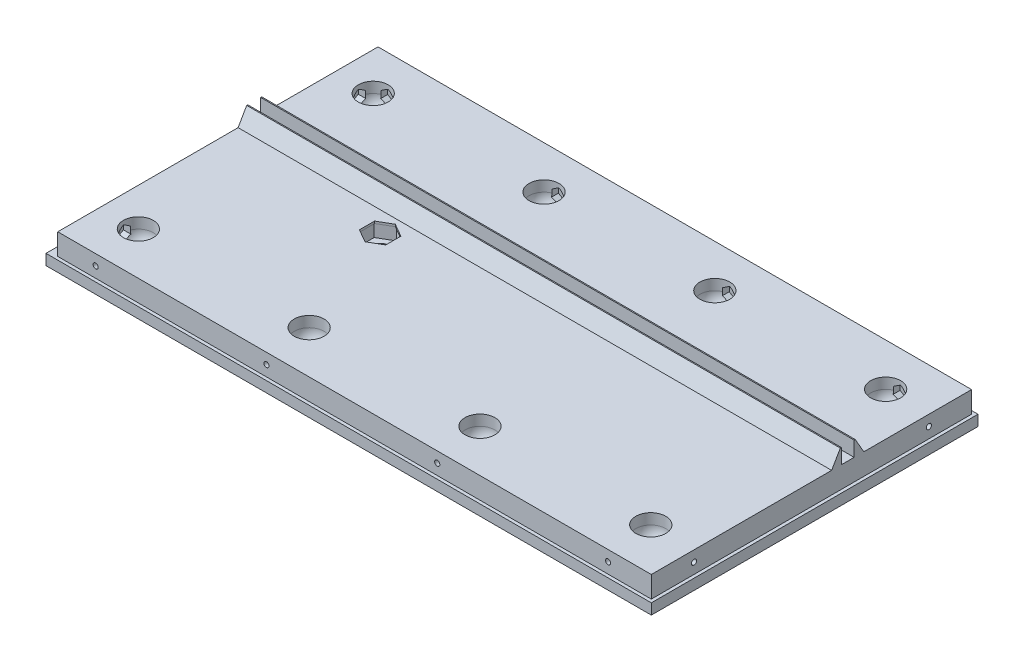
from build123d import *

# Parameters (mm, degrees)
ESQUISSE1_W                     = 283.5
ESQUISSE1_H                     = 153
BOSS_EXTRU_1_DEPTH              = 15
ENL_V_START                     = -5
ESQUISSE3_W                     = 283.5
ESQUISSE3_H                     = 153
ESQUISSE3_W_2                   = 280.5
ESQUISSE3_H_2                   = 150
ENL_V_DE_MAT_EXTRU_MINCE1_DEPTH = 157.772409576
ESQUISSE4_R                     = 1.2
ENL_V_MAT_EXTRU_1_DEPTH         = 12
ENL_V_MAT_EXTRU_2_DEPTH         = 3.5
ESQUISSE6_R                     = 1.2
ENL_V_MAT_EXTRU_3_DEPTH         = 12
ENL_V_MAT_EXTRU_4_DEPTH         = 3.5
R_P_TITION_LIN_AIRE1_COUNT      = 4
R_P_TITION_LIN_AIRE1_PITCH      = 80
SYM_TRIE1_COPY_1_SKETCH_R       = 1.2
SYM_TRIE1_COPY_1_DEPTH          = 12
SYM_TRIE1_COPY_2_SKETCH_R       = 1.2
SYM_TRIE1_COPY_2_DEPTH          = 12
SYM_TRIE1_COPY_3_SKETCH_R       = 1.2
SYM_TRIE1_COPY_3_DEPTH          = 12
SYM_TRIE1_COPY_4_DEPTH          = 3.5
SYM_TRIE1_COPY_5_DEPTH          = 3.5
SYM_TRIE1_COPY_6_DEPTH          = 3.5
SYM_TRIE1_COPY_10_SKETCH_R      = 1.2
SYM_TRIE1_COPY_10_DEPTH         = 12
SYM_TRIE1_COPY_11_DEPTH         = 3.5
ESQUISSE10_R                    = 4
ENL_V_MAT_EXTRU_6_DEPTH         = 8
ENL_V_MAT_EXTRU_7_DEPTH         = 162.274029217
BOSS_EXTRU_2_START              = 6
BOSS_EXTRU_2_DEPTH              = 1
ESQUISSE13_W                    = 4
ESQUISSE13_H                    = 10
ENL_V_MAT_EXTRU_8_DEPTH         = 209.015173725
BOSS_EXTRU_3_DEPTH              = 278


with BuildPart() as part:
    # Esquisse1 → Boss.-Extru.1 (new body)
    with BuildSketch(Plane(origin=(0, 0, 0), x_dir=(1, 0, 0), z_dir=(0, 1, 0))):
        Rectangle(ESQUISSE1_W, ESQUISSE1_H)
    extrude(amount=BOSS_EXTRU_1_DEPTH)

    # Esquisse3 → Enlèv. de mat.-Extru.-Mince1 (cut, through all)
    with BuildSketch(Plane.XZ.offset(ENL_V_START)):
        Rectangle(ESQUISSE3_W, ESQUISSE3_H)
        Rectangle(ESQUISSE3_W_2, ESQUISSE3_H_2, mode=Mode.SUBTRACT)
    extrude(amount=-ENL_V_DE_MAT_EXTRU_MINCE1_DEPTH, mode=Mode.SUBTRACT)

    # Esquisse4 → Enlèv. mat.-Extru.1 (cut)
    with BuildSketch(Plane(origin=(141.75, 0, 0), x_dir=(0, 0, -1), z_dir=(1, 0, 0))):
        with Locations((-55, 10)):
            Circle(ESQUISSE4_R)
    enl_v_mat_extru_1 = extrude(amount=-ENL_V_MAT_EXTRU_1_DEPTH, mode=Mode.SUBTRACT)

    # Esquisse5 → Enlèv. mat.-Extru.2 (cut)
    with BuildSketch(Plane(origin=(129.75, 0, 0), x_dir=(0, 0, -1), z_dir=(1, 0, 0))):
        Polygon((-52.25, 11.58771324), (-55, 13.175426481), (-57.75, 11.58771324), (-57.75, 8.41228676), (-55, 6.824573519), (-52.25, 8.41228676), align=None)
    enl_v_mat_extru_2 = extrude(amount=-ENL_V_MAT_EXTRU_2_DEPTH, mode=Mode.SUBTRACT)

    # Esquisse6 → Enlèv. mat.-Extru.3 (cut)
    with BuildSketch(Plane.XY.offset(76.5)):
        with Locations((120, 10)):
            Circle(ESQUISSE6_R)
    enl_v_mat_extru_3 = extrude(amount=-ENL_V_MAT_EXTRU_3_DEPTH, mode=Mode.SUBTRACT)

    # Esquisse7 → Enlèv. mat.-Extru.4 (cut)
    with BuildSketch(Plane.XY.offset(64.5)):
        Polygon((122.75, 11.58771324), (120, 13.175426481), (117.25, 11.58771324), (117.25, 8.41228676), (120, 6.824573519), (122.75, 8.41228676), align=None)
    enl_v_mat_extru_4 = extrude(amount=-ENL_V_MAT_EXTRU_4_DEPTH, mode=Mode.SUBTRACT)

    # Esquisse9 → Enlèvement de matière-Révolution1 (revolve, cut)
    with BuildSketch(Plane.XY.offset(55)):
        with BuildLine():
            Line((120, 15), (120, 3))
            ThreePointArc((120, 3), (124.949747468, 5.050252532), (127, 10))
            Line((127, 10), (127, 15))
            Line((127, 15), (120, 15))
        make_face()
    enl_vement_de_mati_re_r_volution1 = revolve(axis=Axis((120, 27, 55), (0, -1, 0)), mode=Mode.SUBTRACT)

    # Répétition linéaire1: Enlèv. mat.-Extru.3, Enlèv. mat.-Extru.4, Enlèvement de matière-Révolution1 ×4
    with Locations(*[(-i * R_P_TITION_LIN_AIRE1_PITCH, 0, 0) for i in range(1, R_P_TITION_LIN_AIRE1_COUNT)]):
        add(enl_v_mat_extru_3, mode=Mode.SUBTRACT)
        add(enl_v_mat_extru_4, mode=Mode.SUBTRACT)
        add(enl_vement_de_mati_re_r_volution1, mode=Mode.SUBTRACT)

    # Symétrie2: Enlèv. mat.-Extru.1, Enlèv. mat.-Extru.2 across plane
    add(enl_v_mat_extru_1.mirror(Plane(origin=(0, 0, 0), x_dir=(0, 0, 1), z_dir=(1, 0, 0))), mode=Mode.SUBTRACT)
    add(enl_v_mat_extru_2.mirror(Plane(origin=(0, 0, 0), x_dir=(0, 0, 1), z_dir=(1, 0, 0))), mode=Mode.SUBTRACT)

    # Symétrie1: Enlèv. mat.-Extru.1, Enlèv. mat.-Extru.2, Enlèv. mat.-Extru.3, Enlèv. mat.-Extru.4, Enlèvement de matière-Révolution1 across plane
    add(enl_v_mat_extru_1.mirror(Plane.XY), mode=Mode.SUBTRACT)
    add(enl_v_mat_extru_2.mirror(Plane.XY), mode=Mode.SUBTRACT)
    add(enl_v_mat_extru_3.mirror(Plane.XY), mode=Mode.SUBTRACT)
    add(enl_v_mat_extru_4.mirror(Plane.XY), mode=Mode.SUBTRACT)
    add(enl_vement_de_mati_re_r_volution1.mirror(Plane.XY), mode=Mode.SUBTRACT)

    # Symétrie1 copy 1 sketch → Symétrie1 copy 1 (cut)
    with BuildSketch(Plane(origin=(-80, 0, -76.5), x_dir=(1, 0, 0), z_dir=(0, 0, -1))):
        with Locations((120, -10)):
            Circle(SYM_TRIE1_COPY_1_SKETCH_R)
    extrude(amount=-SYM_TRIE1_COPY_1_DEPTH, mode=Mode.SUBTRACT)

    # Symétrie1 copy 2 sketch → Symétrie1 copy 2 (cut)
    with BuildSketch(Plane(origin=(-160, 0, -76.5), x_dir=(1, 0, 0), z_dir=(0, 0, -1))):
        with Locations((120, -10)):
            Circle(SYM_TRIE1_COPY_2_SKETCH_R)
    extrude(amount=-SYM_TRIE1_COPY_2_DEPTH, mode=Mode.SUBTRACT)

    # Symétrie1 copy 3 sketch → Symétrie1 copy 3 (cut)
    with BuildSketch(Plane(origin=(-240, 0, -76.5), x_dir=(1, 0, 0), z_dir=(0, 0, -1))):
        with Locations((120, -10)):
            Circle(SYM_TRIE1_COPY_3_SKETCH_R)
    extrude(amount=-SYM_TRIE1_COPY_3_DEPTH, mode=Mode.SUBTRACT)

    # Symétrie1 copy 4 sketch → Symétrie1 copy 4 (cut)
    with BuildSketch(Plane(origin=(-80, 0, -64.5), x_dir=(1, 0, 0), z_dir=(0, 0, -1))):
        Polygon((122.75, -11.58771324), (120, -13.175426481), (117.25, -11.58771324), (117.25, -8.41228676), (120, -6.824573519), (122.75, -8.41228676), align=None)
    extrude(amount=-SYM_TRIE1_COPY_4_DEPTH, mode=Mode.SUBTRACT)

    # Symétrie1 copy 5 sketch → Symétrie1 copy 5 (cut)
    with BuildSketch(Plane(origin=(-160, 0, -64.5), x_dir=(1, 0, 0), z_dir=(0, 0, -1))):
        Polygon((122.75, -11.58771324), (120, -13.175426481), (117.25, -11.58771324), (117.25, -8.41228676), (120, -6.824573519), (122.75, -8.41228676), align=None)
    extrude(amount=-SYM_TRIE1_COPY_5_DEPTH, mode=Mode.SUBTRACT)

    # Symétrie1 copy 6 sketch → Symétrie1 copy 6 (cut)
    with BuildSketch(Plane(origin=(-240, 0, -64.5), x_dir=(1, 0, 0), z_dir=(0, 0, -1))):
        Polygon((122.75, -11.58771324), (120, -13.175426481), (117.25, -11.58771324), (117.25, -8.41228676), (120, -6.824573519), (122.75, -8.41228676), align=None)
    extrude(amount=-SYM_TRIE1_COPY_6_DEPTH, mode=Mode.SUBTRACT)

    # Symétrie1 copy 7 sketch → Symétrie1 copy 7 (revolve, cut)
    with BuildSketch(Plane(origin=(-80, 0, -55), x_dir=(1, 0, 0), z_dir=(0, 0, -1))):
        with BuildLine():
            Line((120, -15), (120, -3))
            ThreePointArc((120, -3), (124.949747468, -5.050252532), (127, -10))
            Line((127, -10), (127, -15))
            Line((127, -15), (120, -15))
        make_face()
    revolve(axis=Axis((40, 27, -55), (0, 1, 0)), mode=Mode.SUBTRACT)

    # Symétrie1 copy 8 sketch → Symétrie1 copy 8 (revolve, cut)
    with BuildSketch(Plane(origin=(-160, 0, -55), x_dir=(1, 0, 0), z_dir=(0, 0, -1))):
        with BuildLine():
            Line((120, -15), (120, -3))
            ThreePointArc((120, -3), (124.949747468, -5.050252532), (127, -10))
            Line((127, -10), (127, -15))
            Line((127, -15), (120, -15))
        make_face()
    revolve(axis=Axis((-40, 27, -55), (0, 1, 0)), mode=Mode.SUBTRACT)

    # Symétrie1 copy 9 sketch → Symétrie1 copy 9 (revolve, cut)
    with BuildSketch(Plane(origin=(-240, 0, -55), x_dir=(1, 0, 0), z_dir=(0, 0, -1))):
        with BuildLine():
            Line((120, -15), (120, -3))
            ThreePointArc((120, -3), (124.949747468, -5.050252532), (127, -10))
            Line((127, -10), (127, -15))
            Line((127, -15), (120, -15))
        make_face()
    revolve(axis=Axis((-120, 27, -55), (0, 1, 0)), mode=Mode.SUBTRACT)

    # Symétrie1 copy 10 sketch → Symétrie1 copy 10 (cut)
    with BuildSketch(Plane.ZY.offset(141.75)):
        with Locations((-55, 10)):
            Circle(SYM_TRIE1_COPY_10_SKETCH_R)
    extrude(amount=-SYM_TRIE1_COPY_10_DEPTH, mode=Mode.SUBTRACT)

    # Symétrie1 copy 11 sketch → Symétrie1 copy 11 (cut)
    with BuildSketch(Plane.ZY.offset(129.75)):
        Polygon((-52.25, 11.58771324), (-55, 13.175426481), (-57.75, 11.58771324), (-57.75, 8.41228676), (-55, 6.824573519), (-52.25, 8.41228676), align=None)
    extrude(amount=-SYM_TRIE1_COPY_11_DEPTH, mode=Mode.SUBTRACT)

    # Esquisse10 → Enlèv. mat.-Extru.6 (cut)
    with BuildSketch(Plane.XZ):
        with Locations(Location((-61.75, 0, 0), (0, 0, 270))):
            Circle(ESQUISSE10_R)
    extrude(amount=-ENL_V_MAT_EXTRU_6_DEPTH, mode=Mode.SUBTRACT)

    # Esquisse11 → Enlèv. mat.-Extru.7 (cut, through all)
    with BuildSketch(Plane.XZ.offset(-8)):
        Polygon((-55.2, 3.781644263), (-61.75, 7.563288526), (-68.3, 3.781644263), (-68.3, -3.781644263), (-61.75, -7.563288526), (-55.2, -3.781644263), align=None)
    extrude(amount=-ENL_V_MAT_EXTRU_7_DEPTH, mode=Mode.SUBTRACT)

    # Esquisse12 → Boss.-Extru.2 (add)
    with BuildSketch(Plane(origin=(0, 8, 0), x_dir=(1, 0, 0), z_dir=(0, 1, 0)).offset(BOSS_EXTRU_2_START)):
        Polygon((-55.2, -3.781644263), (-55.2, 3.781644263), (-61.75, 7.563288526), (-68.3, 3.781644263), (-68.3, -3.781644263), (-61.75, -7.563288526), align=None)
        Polygon((-55.6, -3.550704156), (-55.6, 3.550704156), (-61.75, 7.101408311), (-67.9, 3.550704156), (-67.9, -3.550704156), (-61.75, -7.101408311), align=None, mode=Mode.SUBTRACT)
    extrude(amount=BOSS_EXTRU_2_DEPTH)

    # Esquisse13 → Enlèv. mat.-Extru.8 (cut, through all)
    with BuildSketch(Plane.XY.offset(75)):
        with Locations((-139.75, 10)):
            Rectangle(ESQUISSE13_W, ESQUISSE13_H)
    extrude(amount=-ENL_V_MAT_EXTRU_8_DEPTH, mode=Mode.SUBTRACT)

    # Esquisse14 → Boss.-Extru.3 (add)
    with BuildSketch(Plane(origin=(140.25, 0, 0), x_dir=(0, 0, -1), z_dir=(1, 0, 0))):
        Polygon((9.458548116, 15), (14, 15), (14, 22), (13.5, 22), align=None)
        Polygon((20, 15), (20, 22), (20.5, 22), (24.541451884, 15), align=None)
    extrude(amount=-BOSS_EXTRU_3_DEPTH)


solid = part.part
